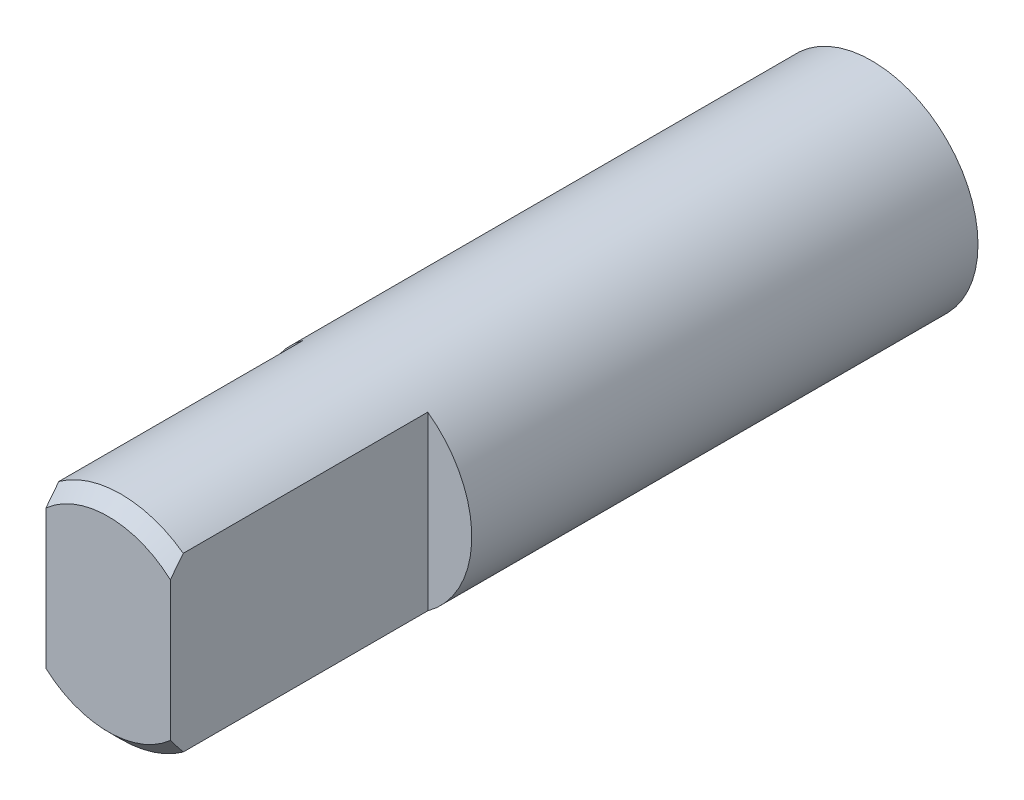
from build123d import *

# Parameters (mm, degrees)
SKETCH1_R           = 2.475
EXTRUDE1_DEPTH      = 17.8
SKETCH2_OUTSIDE_W   = 10.776
SKETCH2_OUTSIDE_H   = 10.776
SKETCH2_OUTSIDE_W_2 = 2.9
SKETCH2_OUTSIDE_H_2 = 7
EXTRUDE2_DEPTH      = 6
CHAMFER1_SIZE       = 0.3


with BuildPart() as part:
    # Sketch1 → Extrude1 (new body)
    with BuildSketch(Plane.XY):
        Circle(SKETCH1_R)
    extrude(amount=EXTRUDE1_DEPTH)

    # Sketch2 outside → Extrude2 (cut)
    with BuildSketch(Plane.XY.offset(17.8)):
        Rectangle(SKETCH2_OUTSIDE_W, SKETCH2_OUTSIDE_H)
        Rectangle(SKETCH2_OUTSIDE_W_2, SKETCH2_OUTSIDE_H_2, mode=Mode.SUBTRACT)
    extrude(amount=-EXTRUDE2_DEPTH, mode=Mode.SUBTRACT)

    # Chamfer1
    chamfer1_edges = [part.edges().sort_by_distance(p)[0] for p in [
        (0, 2.475, 17.8),
        (0, -2.475, 17.8),
    ]]
    chamfer(chamfer1_edges, length=CHAMFER1_SIZE)


solid = part.part
